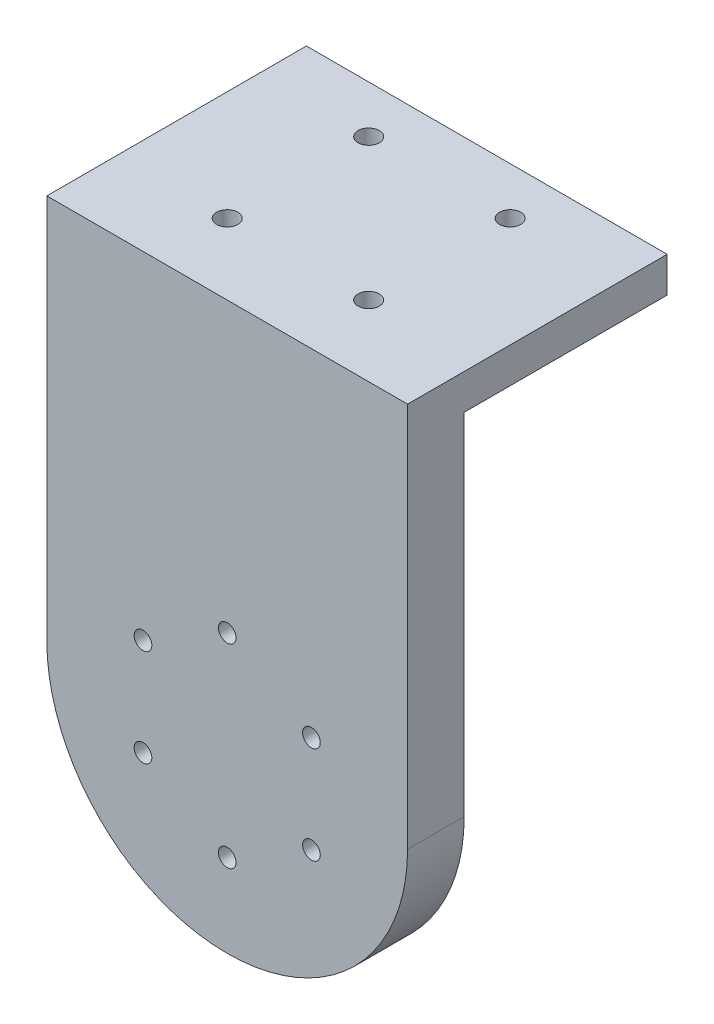
from build123d import *

# Parameters (mm, degrees)
EXTRUDE_1_DEPTH     = 8
SKETCH_2_W          = 51
SKETCH_2_H          = 5
EXTRUDE_2_DEPTH     = 28.7
SKETCH_3_R          = 17.5
CUT_EXTRUDE_1_DEPTH = 2
CUT_EXTRUDE_2_REACH = 82.708
SKETCH_4_R          = 1.25
SKETCH_5_R          = 1.5
CUT_EXTRUDE_3_DEPTH = 5


with BuildPart() as part:
    # 스케치1 → 보스-돌출1 (new body)
    with BuildSketch(Plane.XY):
        with BuildLine():
            Line((0, 0), (0, 54.5))
            Line((0, 54.5), (51, 54.5))
            Line((51, 54.5), (51, 0))
            ThreePointArc((51, 0), (25.5, -25.5), (0, 0))
        make_face()
    extrude(amount=EXTRUDE_1_DEPTH)

    # 스케치2 → 보스-돌출2 (add)
    with BuildSketch(Plane(origin=(0, 0, 0), x_dir=(-1, 0, 0), z_dir=(0, 0, -1))):
        with Locations((-25.5, 52)):
            Rectangle(SKETCH_2_W, SKETCH_2_H)
    extrude(amount=EXTRUDE_2_DEPTH)

    # 스케치3 → 컷-돌출1 (cut)
    with BuildSketch(Plane(origin=(0, 0, 0), x_dir=(-1, 0, 0), z_dir=(0, 0, -1))):
        with Locations((-25.5, 0)):
            Circle(SKETCH_3_R)
    extrude(amount=-CUT_EXTRUDE_1_DEPTH, mode=Mode.SUBTRACT)

    # 스케치4 → 컷-돌출2 (cut, up to next)
    with BuildSketch(Plane(origin=(0, 0, 2), x_dir=(-1, 0, 0), z_dir=(0, 0, -1)), mode=Mode.PRIVATE) as cut_extrude_2_sk1:
        with Locations((-25.5, 13.75)):
            Circle(SKETCH_4_R)
    cut_extrude_2_tool1 = extrude(cut_extrude_2_sk1.sketch, amount=-CUT_EXTRUDE_2_REACH, mode=Mode.PRIVATE) & part.part
    # 스케치4 → 컷-돌출2 (cut, up to next)
    with BuildSketch(Plane(origin=(0, 0, 2), x_dir=(-1, 0, 0), z_dir=(0, 0, -1)), mode=Mode.PRIVATE) as cut_extrude_2_sk2:
        with Locations((-13.592150698, 6.875)):
            Circle(SKETCH_4_R)
    cut_extrude_2_tool2 = extrude(cut_extrude_2_sk2.sketch, amount=-CUT_EXTRUDE_2_REACH, mode=Mode.PRIVATE) & part.part
    # 스케치4 → 컷-돌출2 (cut, up to next)
    with BuildSketch(Plane(origin=(0, 0, 2), x_dir=(-1, 0, 0), z_dir=(0, 0, -1)), mode=Mode.PRIVATE) as cut_extrude_2_sk3:
        with Locations((-13.592150698, -6.875)):
            Circle(SKETCH_4_R)
    cut_extrude_2_tool3 = extrude(cut_extrude_2_sk3.sketch, amount=-CUT_EXTRUDE_2_REACH, mode=Mode.PRIVATE) & part.part
    # 스케치4 → 컷-돌출2 (cut, up to next)
    with BuildSketch(Plane(origin=(0, 0, 2), x_dir=(-1, 0, 0), z_dir=(0, 0, -1)), mode=Mode.PRIVATE) as cut_extrude_2_sk4:
        with Locations((-25.5, -13.75)):
            Circle(SKETCH_4_R)
    cut_extrude_2_tool4 = extrude(cut_extrude_2_sk4.sketch, amount=-CUT_EXTRUDE_2_REACH, mode=Mode.PRIVATE) & part.part
    # 스케치4 → 컷-돌출2 (cut, up to next)
    with BuildSketch(Plane(origin=(0, 0, 2), x_dir=(-1, 0, 0), z_dir=(0, 0, -1)), mode=Mode.PRIVATE) as cut_extrude_2_sk5:
        with Locations((-37.407849302, -6.875)):
            Circle(SKETCH_4_R)
    cut_extrude_2_tool5 = extrude(cut_extrude_2_sk5.sketch, amount=-CUT_EXTRUDE_2_REACH, mode=Mode.PRIVATE) & part.part
    # 스케치4 → 컷-돌출2 (cut, up to next)
    with BuildSketch(Plane(origin=(0, 0, 2), x_dir=(-1, 0, 0), z_dir=(0, 0, -1)), mode=Mode.PRIVATE) as cut_extrude_2_sk6:
        with Locations((-37.407849302, 6.875)):
            Circle(SKETCH_4_R)
    cut_extrude_2_tool6 = extrude(cut_extrude_2_sk6.sketch, amount=-CUT_EXTRUDE_2_REACH, mode=Mode.PRIVATE) & part.part
    add(cut_extrude_2_tool1.solids().sort_by_distance((25.5, 13.75, 2))[0], mode=Mode.SUBTRACT)
    add(cut_extrude_2_tool2.solids().sort_by_distance((13.592151, 6.875, 2))[0], mode=Mode.SUBTRACT)
    add(cut_extrude_2_tool3.solids().sort_by_distance((13.592151, -6.875, 2))[0], mode=Mode.SUBTRACT)
    add(cut_extrude_2_tool4.solids().sort_by_distance((25.5, -13.75, 2))[0], mode=Mode.SUBTRACT)
    add(cut_extrude_2_tool5.solids().sort_by_distance((37.407849, -6.875, 2))[0], mode=Mode.SUBTRACT)
    add(cut_extrude_2_tool6.solids().sort_by_distance((37.407849, 6.875, 2))[0], mode=Mode.SUBTRACT)

    # 스케치5 → 컷-돌출3 (cut)
    with BuildSketch(Plane(origin=(0, 54.5, 0), x_dir=(1, 0, 0), z_dir=(0, 1, 0))):
        with Locations(Location((15.5, 22, 0), (0, 0, 270))):
            Circle(SKETCH_5_R)
        with Locations(Location((35.5, 22, 0), (0, 0, 270))):
            Circle(SKETCH_5_R)
        with Locations(Location((35.5, 2, 0), (0, 0, 270))):
            Circle(SKETCH_5_R)
        with Locations(Location((15.5, 2, 0), (0, 0, 270))):
            Circle(SKETCH_5_R)
    extrude(amount=-CUT_EXTRUDE_3_DEPTH, mode=Mode.SUBTRACT)


solid = part.part
